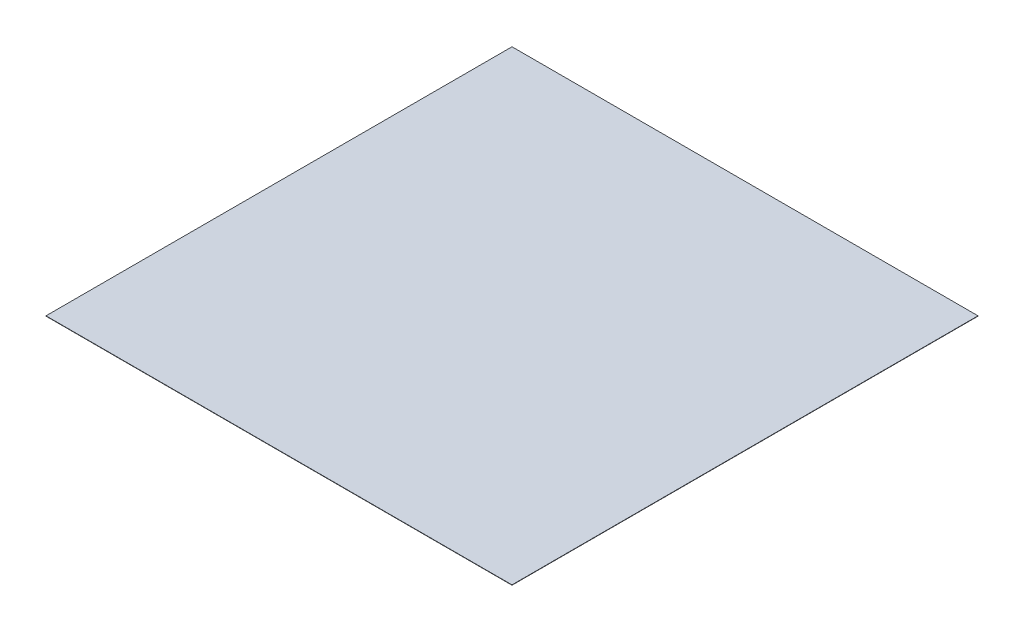
from build123d import *

# Parameters (mm, degrees)
SKETCH1_W           = 14000
SKETCH1_H           = 14000
BOSS_EXTRUDE1_DEPTH = 10


with BuildPart() as part:
    # Sketch1 → Boss-Extrude1 (new body)
    with BuildSketch(Plane(origin=(0, 0, 0), x_dir=(1, 0, 0), z_dir=(0, 1, 0))):
        with Locations((7000, 7000)):
            Rectangle(SKETCH1_W, SKETCH1_H)
    extrude(amount=BOSS_EXTRUDE1_DEPTH)


solid = part.part
